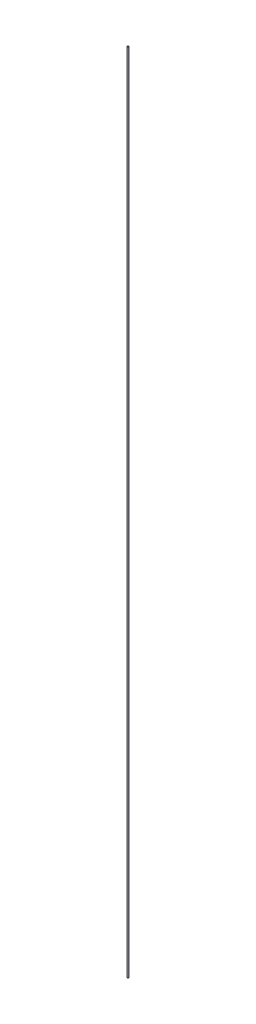
from build123d import *

# Parameters (mm, degrees)
SWEEP1_PROFILE_R = 6.35


with BuildPart() as part:
    # Sweep1: sweep along a path in Sketch1
    with BuildLine(Plane.XY) as sweep1_path:
        Line((0, 0), (0, 8304.784))
    # Sweep1 profile (on start of the path) → Sweep1 (sweep)
    with BuildSketch(Plane.ZX):
        Circle(SWEEP1_PROFILE_R)
    sweep(path=sweep1_path.line)


solid = part.part
